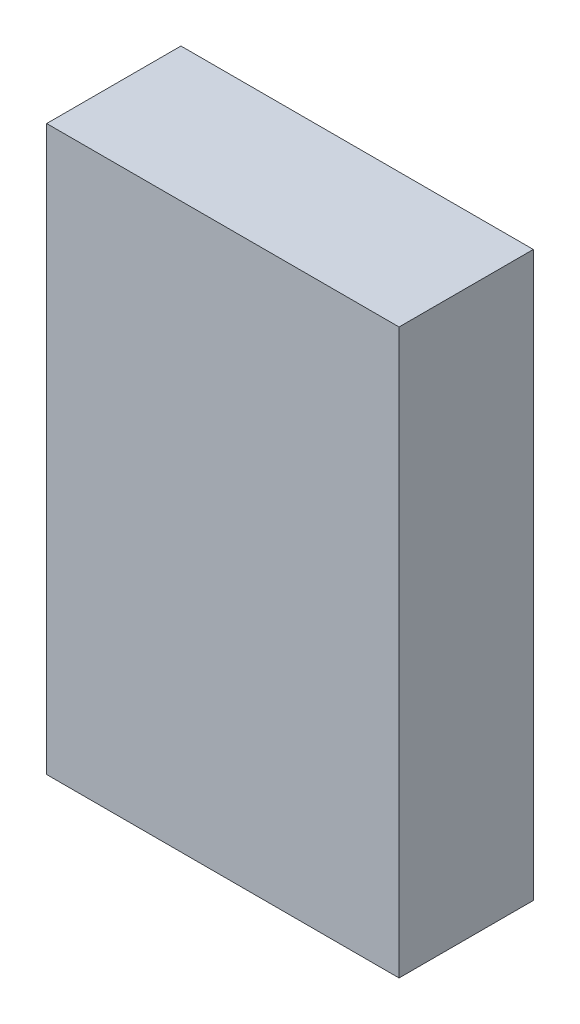
from build123d import *

# Parameters (mm, degrees)
SKETCH1_W           = 25
SKETCH1_H           = 40
BOSS_EXTRUDE1_DEPTH = 9.525


with BuildPart() as part:
    # Sketch1 → Boss-Extrude1 (new body)
    with BuildSketch(Plane.XY):
        Rectangle(SKETCH1_W, SKETCH1_H)
    extrude(amount=BOSS_EXTRUDE1_DEPTH)


solid = part.part
